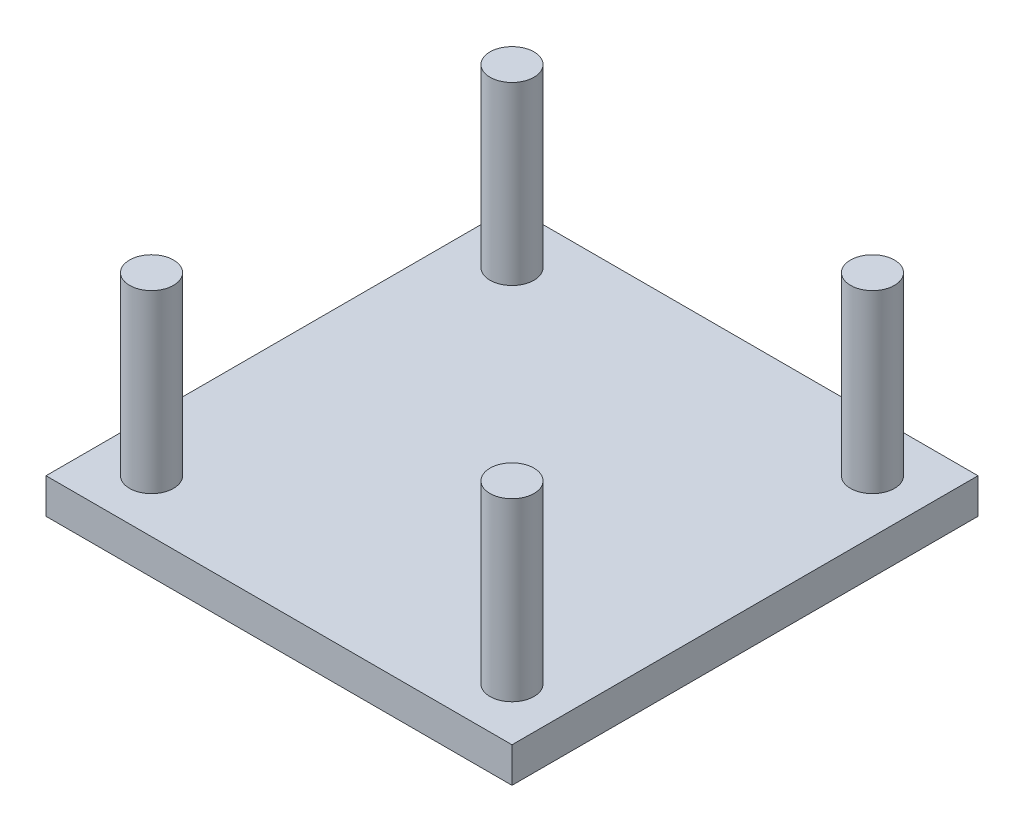
from build123d import *

# Parameters (mm, degrees)
SKETCH1_R             = 1.25
BOSS_EXTRUDE1_DEPTH   = 10
BOSS_EXTRUDE1_2_DEPTH = 10
BOSS_EXTRUDE1_3_DEPTH = 10
BOSS_EXTRUDE1_4_DEPTH = 10
SKETCH2_W             = 26.5
SKETCH2_H             = 26.5
BOSS_EXTRUDE2_DEPTH   = 2
SKETCH3_R             = 1
CUT_EXTRUDE1_DEPTH    = 1.5


with BuildPart() as part:
    # Sketch1 → Boss-Extrude1 (new body)
    with BuildSketch(Plane(origin=(0, 0, 0), x_dir=(1, 0, 0), z_dir=(0, 1, 0))):
        with Locations(Location((-10.25, -10.25, 0), (0, 0, 270))):
            Circle(SKETCH1_R)
    extrude(amount=BOSS_EXTRUDE1_DEPTH)



with BuildPart() as body_2:
    # Sketch1 → Boss-Extrude1 2 (new body)
    with BuildSketch(Plane(origin=(0, 0, 0), x_dir=(1, 0, 0), z_dir=(0, 1, 0))):
        with Locations(Location((-10.25, 10.25, 0), (0, 0, 270))):
            Circle(SKETCH1_R)
    extrude(amount=BOSS_EXTRUDE1_2_DEPTH)


with BuildPart() as body_3:
    # Sketch1 → Boss-Extrude1 3 (new body)
    with BuildSketch(Plane(origin=(0, 0, 0), x_dir=(1, 0, 0), z_dir=(0, 1, 0))):
        with Locations(Location((10.25, 10.25, 0), (0, 0, 270))):
            Circle(SKETCH1_R)
    extrude(amount=BOSS_EXTRUDE1_3_DEPTH)


with BuildPart() as body_4:
    # Sketch1 → Boss-Extrude1 4 (new body)
    with BuildSketch(Plane(origin=(0, 0, 0), x_dir=(1, 0, 0), z_dir=(0, 1, 0))):
        with Locations(Location((10.25, -10.25, 0), (0, 0, 270))):
            Circle(SKETCH1_R)
    extrude(amount=BOSS_EXTRUDE1_4_DEPTH)


with BuildPart() as part_1:
    add(part.part)

    add(body_2.part)  # Boss-Extrude2 merges body 2

    add(body_3.part)  # Boss-Extrude2 merges body 3

    add(body_4.part)  # Boss-Extrude2 merges body 4
    # Sketch2 → Boss-Extrude2 (add)
    with BuildSketch(Plane.XZ):
        Rectangle(SKETCH2_W, SKETCH2_H)
    extrude(amount=BOSS_EXTRUDE2_DEPTH)

    # Sketch3 → Cut-Extrude1 (cut)
    with BuildSketch(Plane.XZ.offset(2)):
        with Locations(Location((-4, -10.25, 0), (0, 0, 270))):
            Circle(SKETCH3_R)
        with Locations(Location((4, -10.25, 0), (0, 0, 270))):
            Circle(SKETCH3_R)
    extrude(amount=-CUT_EXTRUDE1_DEPTH, mode=Mode.SUBTRACT)


solid = part_1.part
